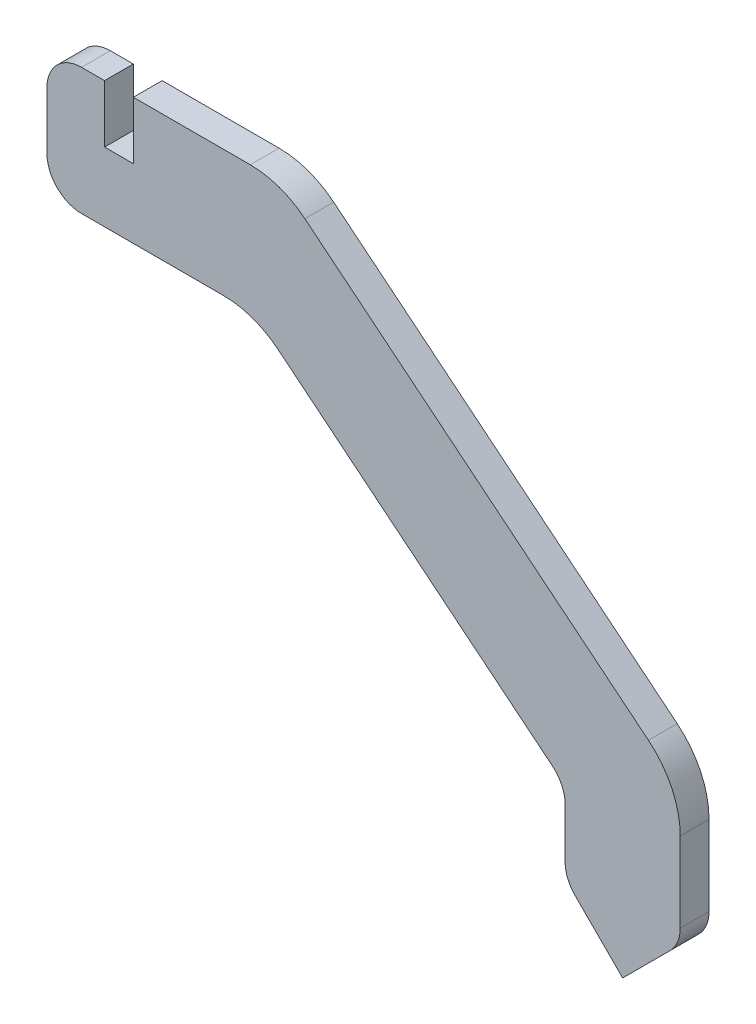
from build123d import *

# Parameters (mm, degrees)
BOSS_EXTRUDE1_DEPTH = 0.125
FILLET1_R           = 0.3
FILLET2_R           = 0.75


with BuildPart() as part:
    # frame_outline → Boss-Extrude1 (new, symmetric)
    with BuildSketch(Plane.XY):
        Polygon((0, 0), (0, 1.1), (0.5, 1.1), (0.5, 0.6), (0.75, 0.6), (0.75, 1.1), (2.033097706, 1.1), (5.5, -1.724883351), (5.5, -2.9), (5, -3.4), (4.5, -2.9), (4.5, -2.2), (1.8, 0), align=None)
    extrude(amount=BOSS_EXTRUDE1_DEPTH, both=True)

    # Fillet1
    fillet1_edges = [part.edges().sort_by_distance(p)[0] for p in [
        (0, 0, 0),
        (0, 1.1, 0),
        (5.5, -2.9, 0),
        (4.5, -2.9, 0),
        (4.5, -2.2, 0),
    ]]
    fillet(fillet1_edges, radius=FILLET1_R)

    # Fillet2
    fillet2_edges = [part.edges().sort_by_distance(p)[0] for p in [
        (2.033097706, 1.1, 0),
        (5.5, -1.724883351, 0),
        (1.8, 0, 0),
    ]]
    fillet(fillet2_edges, radius=FILLET2_R)


solid = part.part
